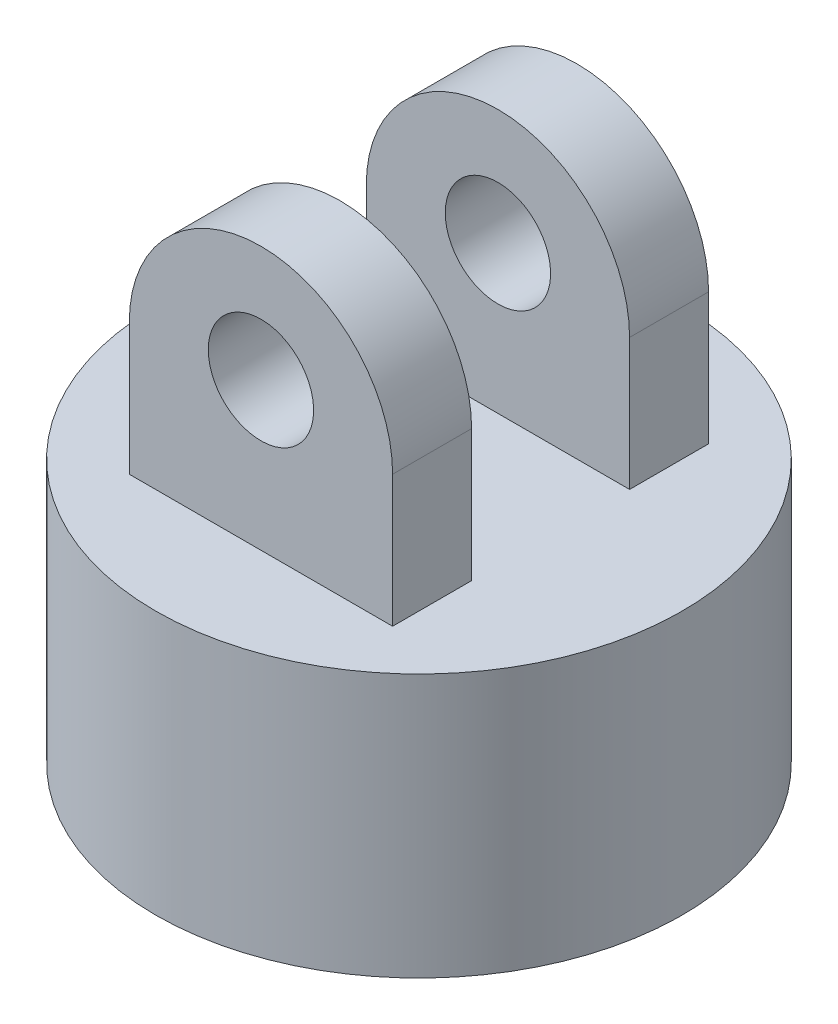
from build123d import *

# Parameters (mm, degrees)
CROQUIS1_R              = 50
SALIENTE_EXTRUIR1_DEPTH = 50
CROQUIS2_W              = 50
CROQUIS2_H              = 15
SALIENTE_EXTRUIR2_DEPTH = 50
CROQUIS4_R              = 10
CORTAR_EXTRUIR1_DEPTH   = 60
REDONDEO1_RADIUS        = 25
REDONDEO1_LENGTH        = 15
REDONDEO2_RADIUS        = 25
REDONDEO2_LENGTH        = 15


with BuildPart() as part:
    # Croquis1 → Saliente-Extruir1 (new body)
    with BuildSketch(Plane(origin=(0, 0, 0), x_dir=(1, 0, 0), z_dir=(0, 1, 0))):
        with Locations(Location((0, 0, 0), (0, 0, 270))):
            Circle(CROQUIS1_R)
    extrude(amount=SALIENTE_EXTRUIR1_DEPTH)

    # Croquis2 → Saliente-Extruir2 (add)
    with BuildSketch(Plane(origin=(0, 50, 0), x_dir=(1, 0, 0), z_dir=(0, 1, 0))):
        with Locations((0, 22.5)):
            Rectangle(CROQUIS2_W, CROQUIS2_H)
        with Locations((0, -22.5)):
            Rectangle(CROQUIS2_W, CROQUIS2_H)
    extrude(amount=SALIENTE_EXTRUIR2_DEPTH)

    # Croquis4 → Cortar-Extruir1 (cut)
    with BuildSketch(Plane(origin=(0, 0, -30), x_dir=(-1, 0, 0), z_dir=(0, 0, -1))):
        with Locations((0, 78)):
            Circle(CROQUIS4_R)
    extrude(amount=-CORTAR_EXTRUIR1_DEPTH, mode=Mode.SUBTRACT)

    # Redondeo1: full round fillet: the end face becomes a half cylinder, R = half its width
    redondeo1_face = Plane((0, 100, -22.5), x_dir=(0, 0, 1), z_dir=(0, 1, 0))  # on the end face: x along it, z out of the body
    redondeo1_slab = redondeo1_face.offset(-REDONDEO1_RADIUS / 2) * Box(REDONDEO1_LENGTH, 2 * REDONDEO1_RADIUS, REDONDEO1_RADIUS, mode=Mode.PRIVATE)  # the body's end, R deep
    redondeo1_round = Plane((0, 75, -22.5), x_dir=(0, 1, 0), z_dir=(0, 0, 1)) * Cylinder(REDONDEO1_RADIUS, REDONDEO1_LENGTH, mode=Mode.PRIVATE)  # its axis R under the face
    add(redondeo1_slab - redondeo1_round, mode=Mode.SUBTRACT)

    # Redondeo2: full round fillet: the end face becomes a half cylinder, R = half its width
    redondeo2_face = Plane((0, 100, 22.5), x_dir=(0, 0, 1), z_dir=(0, 1, 0))  # on the end face: x along it, z out of the body
    redondeo2_slab = redondeo2_face.offset(-REDONDEO2_RADIUS / 2) * Box(REDONDEO2_LENGTH, 2 * REDONDEO2_RADIUS, REDONDEO2_RADIUS, mode=Mode.PRIVATE)  # the body's end, R deep
    redondeo2_round = Plane((0, 75, 22.5), x_dir=(0, 1, 0), z_dir=(0, 0, 1)) * Cylinder(REDONDEO2_RADIUS, REDONDEO2_LENGTH, mode=Mode.PRIVATE)  # its axis R under the face
    add(redondeo2_slab - redondeo2_round, mode=Mode.SUBTRACT)


solid = part.part
